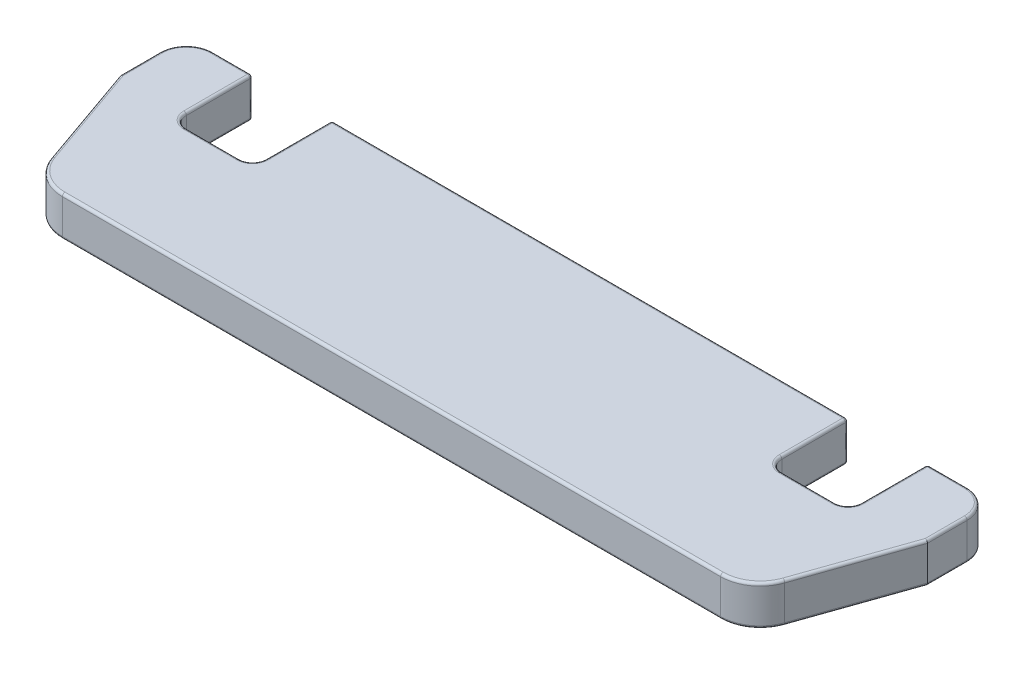
from build123d import *

# Parameters (mm, degrees)
BOSS_EXTRUDE1_DEPTH = 3
FILLET1_R           = 0.2


with BuildPart() as part:
    # Sketch1 → Boss-Extrude1 (new body)
    with BuildSketch(Plane(origin=(0, 0, 0), x_dir=(1, 0, 0), z_dir=(0, 1, 0))):
        with BuildLine():
            Line((19.5, 15), (-19.5, 15))
            Line((-19.5, 15), (-19.5, 10))
            ThreePointArc((-19.5, 10), (-19.792893219, 9.292893219), (-20.5, 9))
            Line((-20.5, 9), (-24.5, 9))
            ThreePointArc((-24.5, 9), (-25.207106781, 9.292893219), (-25.5, 10))
            Line((-25.5, 10), (-25.5, 15))
            Line((-25.5, 15), (-28.5, 15))
            ThreePointArc((-28.5, 15), (-29.914213562, 14.414213562), (-30.5, 13))
            Line((-30.5, 13), (-30.5, 10))
            Line((-30.5, 10), (-27.703132054, 2.008948726))
            ThreePointArc((-27.703132054, 2.008948726), (-26.60747838, 0.553251768), (-24.871556985, 0))
            Line((-24.871556985, 0), (24.871556985, 0))
            ThreePointArc((24.871556985, 0), (26.60747838, 0.553251768), (27.703132054, 2.008948726))
            Line((27.703132054, 2.008948726), (30.5, 10))
            Line((30.5, 10), (30.5, 13))
            ThreePointArc((30.5, 13), (29.914213562, 14.414213562), (28.5, 15))
            Line((28.5, 15), (25.5, 15))
            Line((25.5, 15), (25.5, 10))
            ThreePointArc((25.5, 10), (25.207106781, 9.292893219), (24.5, 9))
            Line((24.5, 9), (20.5, 9))
            ThreePointArc((20.5, 9), (19.792893219, 9.292893219), (19.5, 10))
            Line((19.5, 10), (19.5, 15))
        make_face()
    extrude(amount=BOSS_EXTRUDE1_DEPTH)

    # Fillet1
    fillet1_edges = [part.edges().sort_by_distance(p)[0] for p in [
        (-25.207106781, 3, -9.292893219),
        (-25.5, 3, -12.5),
        (-27, 3, -15),
        (-19.5, 0, -12.5),
        (-29.914213562, 3, -14.414213562),
        (0, 0, -15),
        (19.5, 0, -12.5),
        (19.792893219, 0, -9.292893219),
        (22.5, 0, -9),
        (25.207106781, 0, -9.292893219),
        (25.5, 0, -12.5),
        (27, 0, -15),
        (-30.5, 3, -11.5),
        (29.914213562, 0, -14.414213562),
        (30.5, 0, -11.5),
        (29.101566027, 0, -6.004474363),
        (26.60747838, 0, -0.553251768),
        (0, 0, 0),
        (-26.60747838, 0, -0.553251768),
        (-29.101566027, 0, -6.004474363),
        (-30.5, 0, -11.5),
        (-29.101566027, 3, -6.004474363),
        (-29.914213562, 0, -14.414213562),
        (-27, 0, -15),
        (-25.5, 0, -12.5),
        (-25.207106781, 0, -9.292893219),
        (-22.5, 0, -9),
        (-19.792893219, 0, -9.292893219),
        (-26.60747838, 3, -0.553251768),
        (0, 3, 0),
        (26.60747838, 3, -0.553251768),
        (-19.5, 1.5, -15),
        (19.5, 1.5, -15),
        (25.5, 1.5, -15),
        (-25.5, 1.5, -15),
        (29.101566027, 3, -6.004474363),
        (-19.792893219, 3, -9.292893219),
        (30.5, 3, -11.5),
        (29.914213562, 3, -14.414213562),
        (27, 3, -15),
        (25.5, 3, -12.5),
        (25.207106781, 3, -9.292893219),
        (22.5, 3, -9),
        (19.792893219, 3, -9.292893219),
        (19.5, 3, -12.5),
        (0, 3, -15),
        (-19.5, 3, -12.5),
        (-22.5, 3, -9),
    ]]
    fillet(fillet1_edges, radius=FILLET1_R)


solid = part.part
